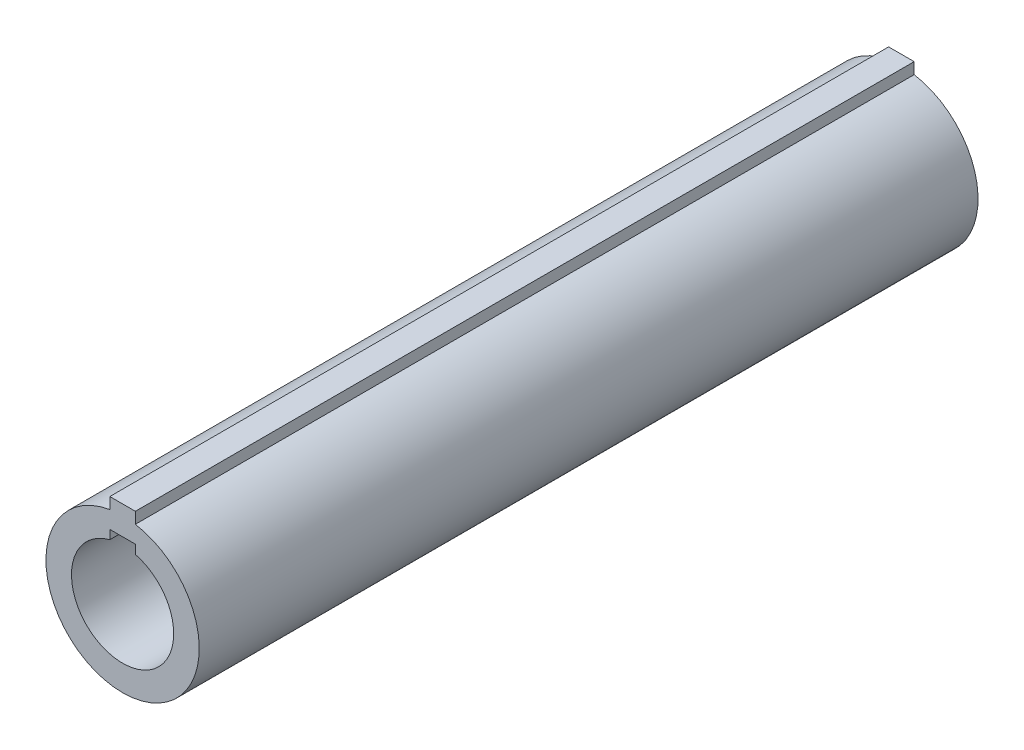
from build123d import *

# Parameters (mm, degrees)
BOSS_EXTRUDE1_DEPTH = 152.4


with BuildPart() as part:
    # Sketch1 → Boss-Extrude1 (new body)
    with BuildSketch(Plane.XY):
        with BuildLine():
            Line((-2.5, 14.790199458), (-2.5, 17))
            Line((-2.5, 17), (2.5, 17))
            Line((2.5, 17), (2.5, 14.790199458))
            ThreePointArc((2.5, 14.790199458), (0, -15), (-2.5, 14.790199458))
        make_face()
        with BuildLine():
            Line((-2.5, 9.682458366), (-2.5, 11.43))
            Line((-2.5, 11.43), (2.5, 11.43))
            Line((2.5, 11.43), (2.5, 9.682458366))
            ThreePointArc((2.5, 9.682458366), (0, -10), (-2.5, 9.682458366))
        make_face(mode=Mode.SUBTRACT)
    extrude(amount=BOSS_EXTRUDE1_DEPTH)


solid = part.part
